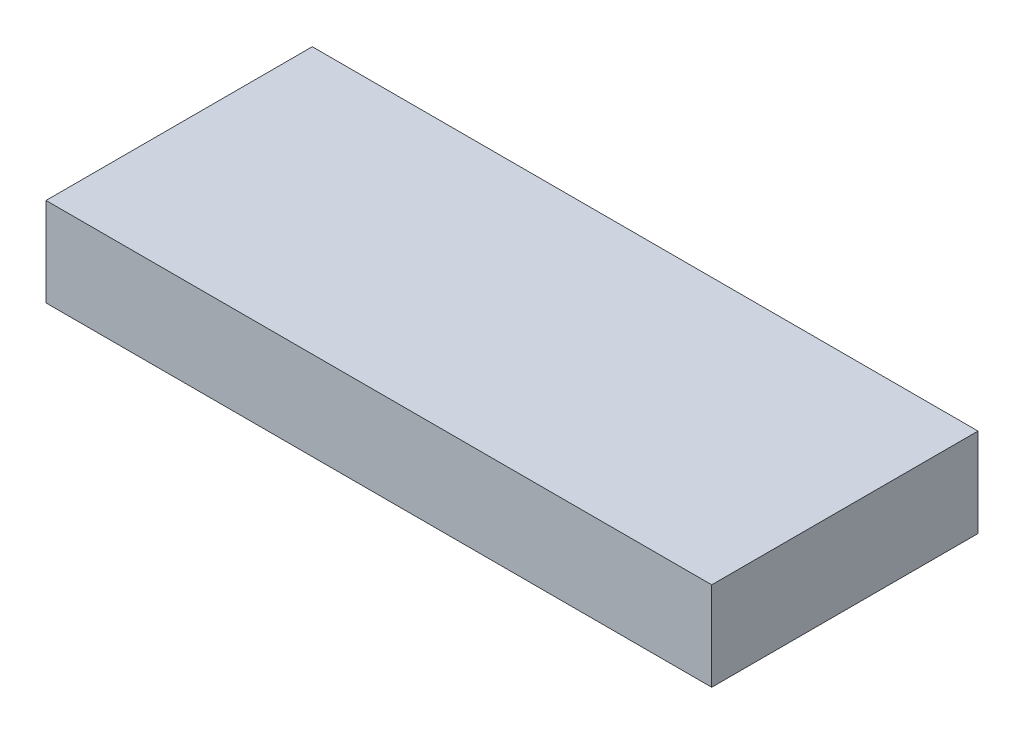
from build123d import *

# Parameters (mm, degrees)
ESQUISSE1_W        = 15
ESQUISSE1_H        = 2
BOSS_EXTRU_1_DEPTH = 6


with BuildPart() as part:
    # Esquisse1 → Boss.-Extru.1 (new body)
    with BuildSketch(Plane.XY):
        Rectangle(ESQUISSE1_W, ESQUISSE1_H)
    extrude(amount=BOSS_EXTRU_1_DEPTH)


solid = part.part
